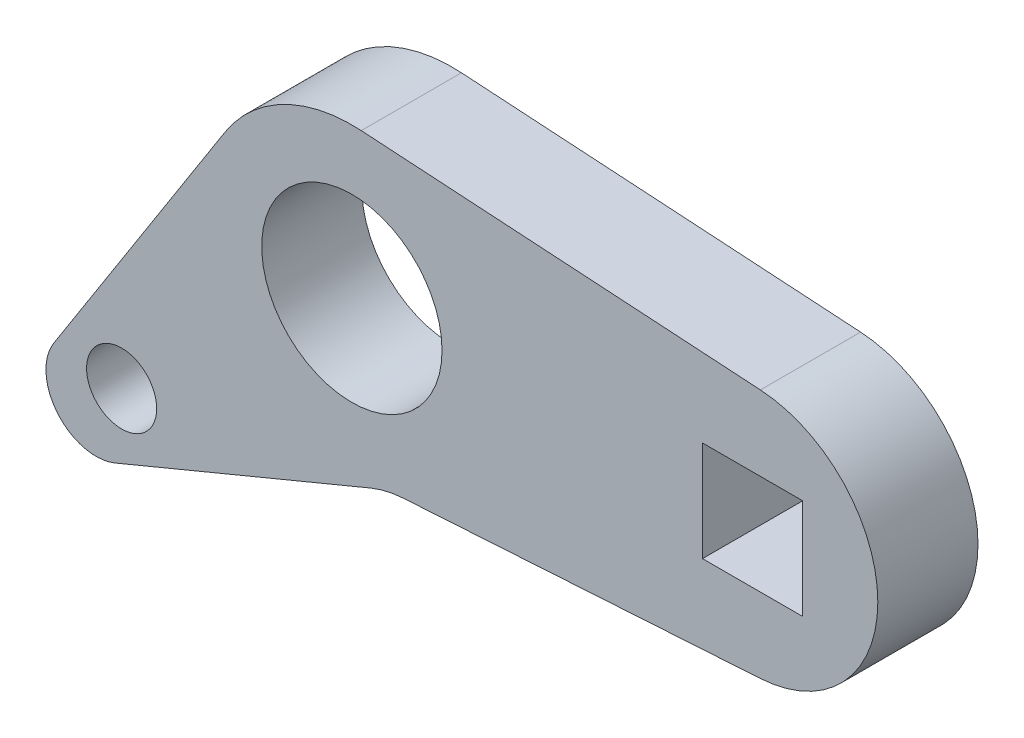
from build123d import *

# Parameters (mm, degrees)
SKETCH_1_R      = 6
SKETCH_1_R_2    = 3.5
SKETCH_1_R_3    = 15
SKETCH_1_R_4    = 9
SKETCH_1_R_5    = 12.5
SKETCH_1_W      = 10
SKETCH_1_H      = 10
EXTRUDE_1_DEPTH = 10
FILLET_1_R      = 5
FILLET_2_R      = 10


with BuildPart() as part:
    # Эскиз1 → Бобышка-Вытянуть1 (new body)
    # profile 1 of 7: a face of its own
    with BuildSketch(Plane.XY):
        with BuildLine():
            Line((-12.64490448, 8.068853121), (-28.039295072, -16.056087022))
            ThreePointArc((-28.039295072, -16.056087022), (-21.300228103, -13.523950753), (-16.981333294, -19.283628291))
            ThreePointArc((-16.981333294, -19.283628291), (-17.991282662, -22.615203698), (-20.681131524, -24.825204945))
            Line((-20.681131524, -24.825204945), (3.437235755, -14.814134934))
            Line((3.437235755, -14.814134934), (0.9375, -14.970674459))
            ThreePointArc((0.9375, -14.970674459), (-12.921717676, -7.617690746), (-12.64490448, 8.068853121))
        make_face()
    # profile 2 of 7: a face of its own
    with BuildSketch(Plane.XY):
        with Locations((-22.981333294, -19.283628291)):
            Circle(SKETCH_1_R)
        with Locations((-22.981333294, -19.283628291)):
            Circle(SKETCH_1_R_2, mode=Mode.SUBTRACT)
    # profile 3 of 7: a face of its own
    with BuildSketch(Plane.XY):
        with BuildLine():
            Line((-28.039295072, -16.056087022), (-38.302222156, -32.139380484))
            Line((-38.302222156, -32.139380484), (-20.681131524, -24.825204945))
            ThreePointArc((-20.681131524, -24.825204945), (-27.57759997, -23.140353928), (-28.039295072, -16.056087022))
        make_face()
    # profile 4 of 7: a face of its own
    with BuildSketch(Plane.XY):
        Circle(SKETCH_1_R_3)
        Circle(SKETCH_1_R_4, mode=Mode.SUBTRACT)
    # profile 5 of 7: a face of its own
    with BuildSketch(Plane.XY):
        with BuildLine():
            Line((5.750504492, -13.853941608), (3.437235755, -14.814134934))
            Line((3.437235755, -14.814134934), (40.78125, -12.475562049))
            ThreePointArc((40.78125, -12.475562049), (27.5, 0), (40.78125, 12.475562049))
            Line((40.78125, 12.475562049), (0.9375, 14.970674459))
            ThreePointArc((0.9375, 14.970674459), (10.933034803, 10.269797953), (15, 0))
            ThreePointArc((15, 0), (12.4751266, -8.328938486), (5.750504492, -13.853941608))
        make_face()
    # profile 6 of 7: a face of its own
    with BuildSketch(Plane.XY):
        with Locations((40, 0)):
            Circle(SKETCH_1_R_5)
        with Locations((40, 0)):
            Rectangle(SKETCH_1_W, SKETCH_1_H, mode=Mode.SUBTRACT)
    # profile 7 of 7: a face of its own
    with BuildSketch(Plane.XY):
        with BuildLine():
            Line((0.9375, -14.970674459), (3.437235755, -14.814134934))
            Line((3.437235755, -14.814134934), (5.750504492, -13.853941608))
            ThreePointArc((5.750504492, -13.853941608), (3.390298525, -14.611840264), (0.9375, -14.970674459))
        make_face()
    extrude(amount=EXTRUDE_1_DEPTH)

    # Скругление1
    fillet_1_edges = [part.edges().sort_by_distance(p)[0] for p in [
        (-38.302222156, -32.139380484, 5),
    ]]
    fillet(fillet_1_edges, radius=FILLET_1_R)

    # Скругление2
    fillet_2_edges = [part.edges().sort_by_distance(p)[0] for p in [
        (3.437235755, -14.814134934, 5),
    ]]
    fillet(fillet_2_edges, radius=FILLET_2_R)


solid = part.part
